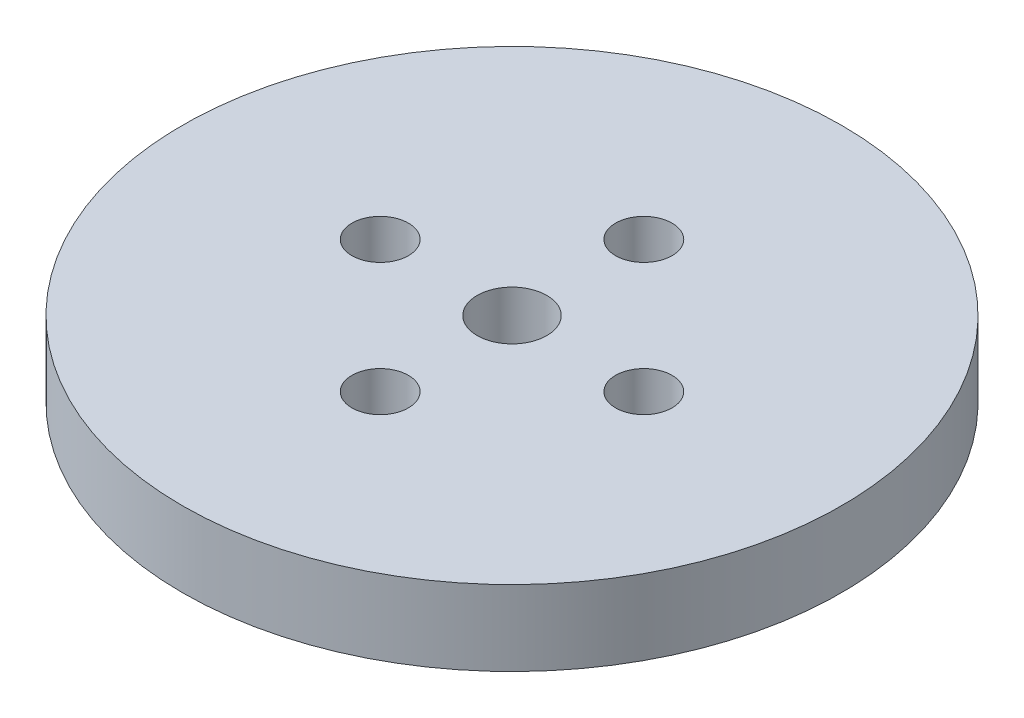
from build123d import *

# Parameters (mm, degrees)
SKETCH1_R           = 17.5
SKETCH1_R_2         = 1.85
SKETCH1_R_3         = 1.5
BOSS_EXTRUDE1_DEPTH = 4


with BuildPart() as part:
    # Sketch1 → Boss-Extrude1 (new body)
    with BuildSketch(Plane(origin=(0, 0, 0), x_dir=(1, 0, 0), z_dir=(0, 1, 0))):
        with Locations(Location((0, 0, 0), (0, 0, 270))):
            Circle(SKETCH1_R)
        with Locations(Location((0, 0, 0), (0, 0, 270))):
            Circle(SKETCH1_R_2, mode=Mode.SUBTRACT)
        with Locations(Location((-7, 0, 0), (0, 0, 270))):
            Circle(SKETCH1_R_3, mode=Mode.SUBTRACT)
        with Locations(Location((0, 7, 0), (0, 0, 270))):
            Circle(SKETCH1_R_3, mode=Mode.SUBTRACT)
        with Locations(Location((7, 0, 0), (0, 0, 270))):
            Circle(SKETCH1_R_3, mode=Mode.SUBTRACT)
        with Locations(Location((0, -7, 0), (0, 0, 270))):
            Circle(SKETCH1_R_3, mode=Mode.SUBTRACT)
    extrude(amount=BOSS_EXTRUDE1_DEPTH)


solid = part.part
